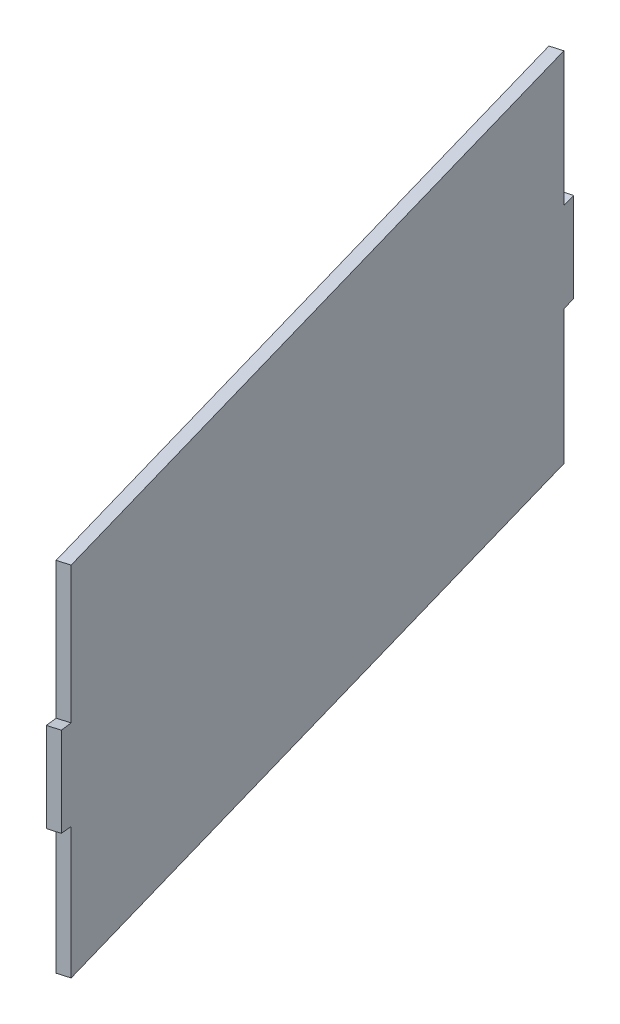
from build123d import *

# Parameters (mm, degrees)
BOSS_EXTRUDE1_DEPTH = 10.16


with BuildPart() as part:
    # Sketch1 → Boss-Extrude1 (new body)
    with BuildSketch(Plane(origin=(972.287594707, 0, -279.761907089), x_dir=(-0.27651668570360943, 0, -0.9610091167764702), z_dir=(0.9610091167764702, 0, -0.27651668570360943))):
        Polygon((2602.330216376, -41.581628832), (1998.345068474, -41.581628832), (1998.345068474, -156.254177234), (1986.345068474, -154.081628832), (1986.345068474, -229.081628832), (1998.345068474, -231.512401326), (1998.345068474, -341.581628832), (2602.330216376, -341.581628832), (2602.330216376, -229.081628832), (2614.330216376, -229.081628832), (2614.330216376, -154.081628832), (2602.330216376, -154.081628832), align=None)
    extrude(amount=-BOSS_EXTRUDE1_DEPTH)


solid = part.part
